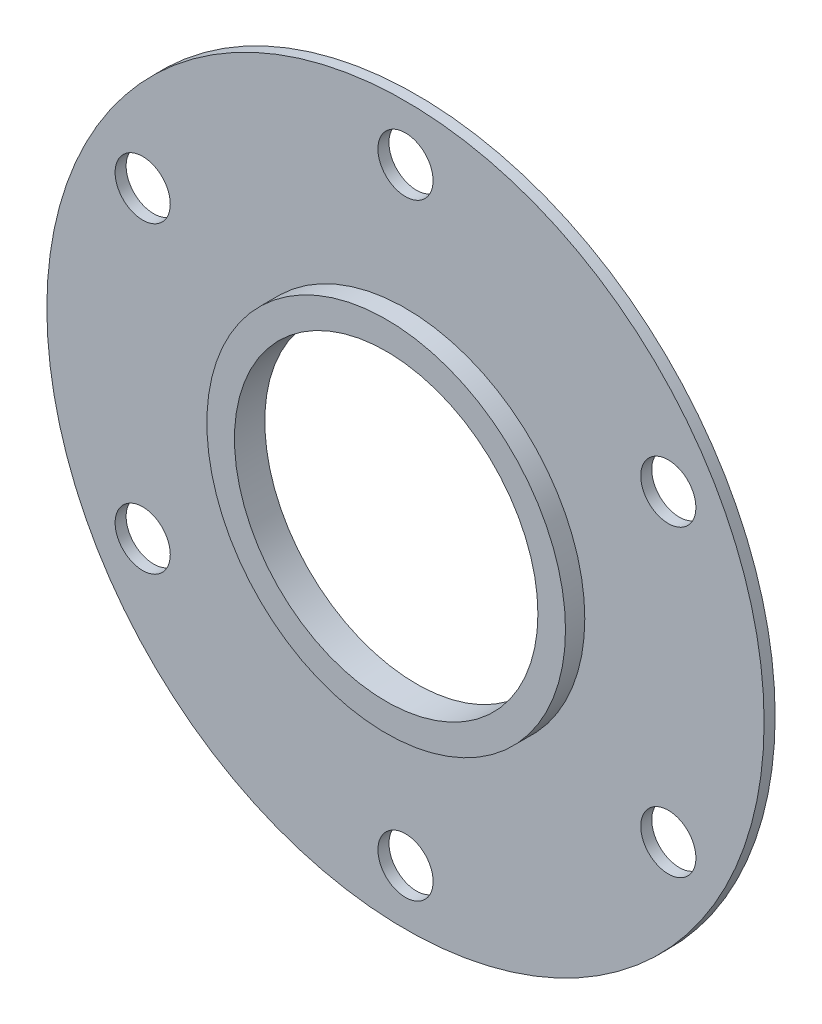
from build123d import *

# Parameters (mm, degrees)
ESQUISSE1_R        = 26
ESQUISSE1_R_2      = 2
ESQUISSE1_R_3      = 11
BOSS_EXTRU_1_DEPTH = 0.8
ESQUISSE2_R        = 13
ESQUISSE2_R_2      = 11
BOSS_EXTRU_2_DEPTH = 1.4


with BuildPart() as part:
    # Esquisse1 → Boss.-Extru.1 (new body)
    with BuildSketch(Plane.XY):
        Circle(ESQUISSE1_R)
        with Locations((0, 22)):
            Circle(ESQUISSE1_R_2, mode=Mode.SUBTRACT)
        with Locations((19.053058883, 11.000866025)):
            Circle(ESQUISSE1_R_2, mode=Mode.SUBTRACT)
        with Locations((19.054058883, -10.999133975)):
            Circle(ESQUISSE1_R_2, mode=Mode.SUBTRACT)
        with Locations((0.002, -22)):
            Circle(ESQUISSE1_R_2, mode=Mode.SUBTRACT)
        with Locations((-19.051058883, -11.000866025)):
            Circle(ESQUISSE1_R_2, mode=Mode.SUBTRACT)
        with Locations((-19.052058883, 10.999133975)):
            Circle(ESQUISSE1_R_2, mode=Mode.SUBTRACT)
        Circle(ESQUISSE1_R_3, mode=Mode.SUBTRACT)
    extrude(amount=BOSS_EXTRU_1_DEPTH)

    # Esquisse2 → Boss.-Extru.2 (add)
    with BuildSketch(Plane.XY.offset(0.8)):
        Circle(ESQUISSE2_R)
        Circle(ESQUISSE2_R_2, mode=Mode.SUBTRACT)
    extrude(amount=BOSS_EXTRU_2_DEPTH)


solid = part.part
